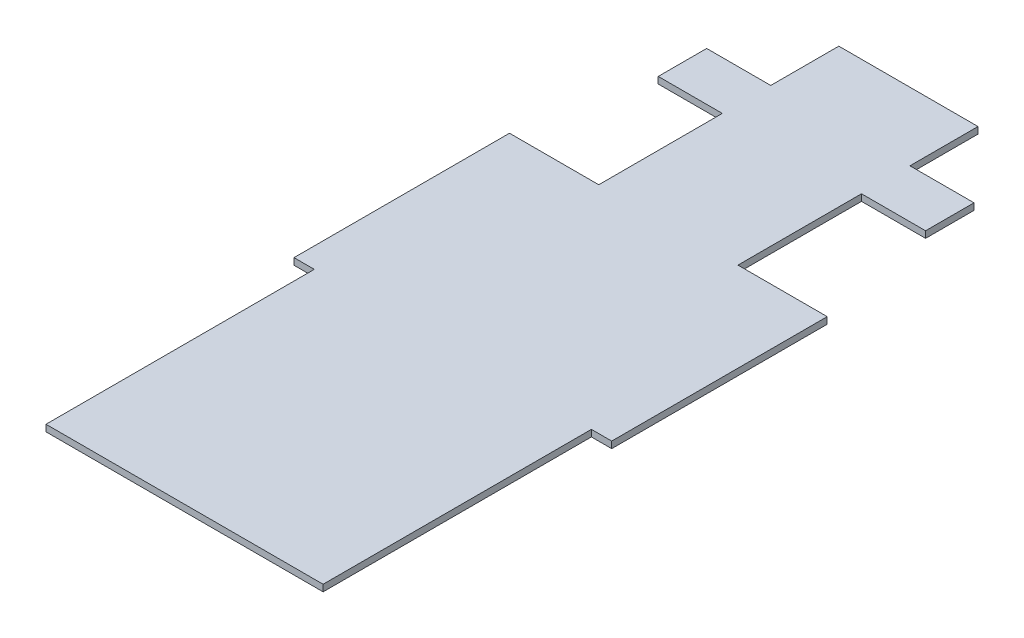
from build123d import *

# Parameters (mm, degrees)
BOSS_EXTRU_6_DEPTH = 1.87


with BuildPart() as part:
    # Esquisse1 → Boss.-Extru.6 (new body)
    with BuildSketch(Plane(origin=(0, 0, 0), x_dir=(1, 0, 0), z_dir=(0, 1, 0))):
        Polygon((45, -30.525), (45, 30.525), (19.715, 30.525), (19.715, 65.525), (37.865, 65.525), (37.865, 79.245), (19.715, 79.245), (19.715, 98.525), (-19.715, 98.525), (-19.715, 79.245), (-37.865, 79.245), (-37.865, 65.525), (-19.715, 65.525), (-19.715, 30.525), (-45, 30.525), (-45, -30.525), (-39.25, -30.525), (-39.25, -106.525), (39.25, -106.525), (39.25, -30.525), align=None)
    extrude(amount=BOSS_EXTRU_6_DEPTH)


solid = part.part
